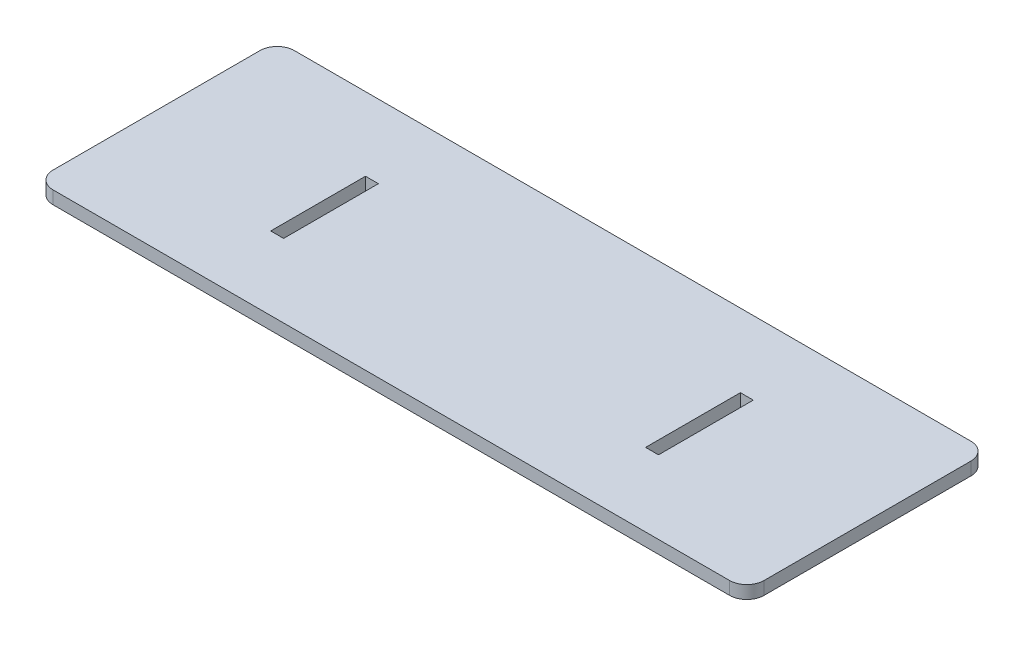
from build123d import *

# Parameters (mm, degrees)
BOSS_EXTRUDE1_DEPTH     = 3
CUT_EXTRUDE1_DEPTH      = 88.17367722
CUT_EXTRUDE1_DEPTH_BACK = 88.17367722
SKETCH2_W               = 3
SKETCH2_H               = 22


with BuildPart() as part:
    # Sketch1 → Boss-Extrude1 (new body)
    with BuildSketch(Plane(origin=(0, 0, 0), x_dir=(1, 0, 0), z_dir=(0, 1, 0))):
        with BuildLine():
            Line((-78.5, -28), (78.5, -28))
            ThreePointArc((78.5, -28), (81.328427125, -26.828427125), (82.5, -24))
            Line((82.5, -24), (82.5, 24))
            ThreePointArc((82.5, 24), (81.328427125, 26.828427125), (78.5, 28))
            Line((78.5, 28), (-78.5, 28))
            ThreePointArc((-78.5, 28), (-81.328427125, 26.828427125), (-82.5, 24))
            Line((-82.5, 24), (-82.5, -24))
            ThreePointArc((-82.5, -24), (-81.328427125, -26.828427125), (-78.5, -28))
        make_face()
    extrude(amount=BOSS_EXTRUDE1_DEPTH)

    # Sketch2 → Cut-Extrude1 (cut, two sides: drawn at the far end of the back side and taken through both)
    with BuildSketch(Plane(origin=(0, 0, 0), x_dir=(1, 0, 0), z_dir=(0, 1, 0)).offset(-CUT_EXTRUDE1_DEPTH_BACK)):
        with Locations((-43.5, 0)):
            Rectangle(SKETCH2_W, SKETCH2_H)
        with Locations((43.5, 0)):
            Rectangle(SKETCH2_W, SKETCH2_H)
    extrude(amount=CUT_EXTRUDE1_DEPTH + CUT_EXTRUDE1_DEPTH_BACK, mode=Mode.SUBTRACT)


solid = part.part
